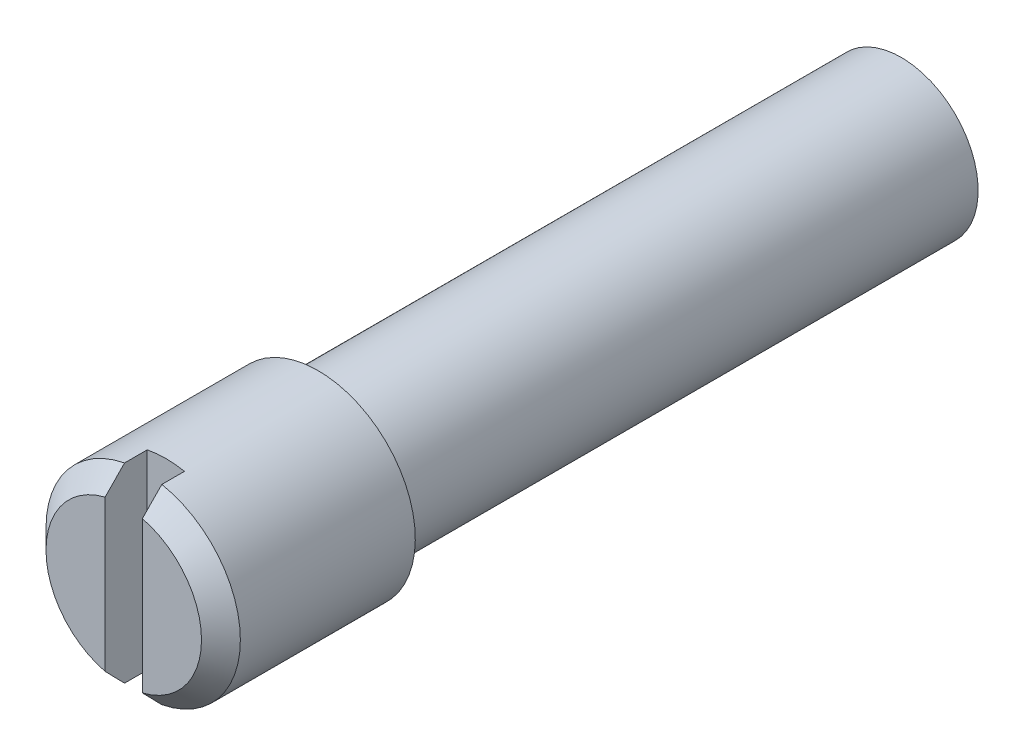
from build123d import *

# Parameters (mm, degrees)
ESQUISSE3_W             = 3
ESQUISSE3_H             = 24
CHANFREIN1_SIZE         = 0.6
ESQUISSE6_R             = 3.5
ENL_V_MAT_EXTRU_1_DEPTH = 25.505101524
ESQUISSE7_OUTSIDE_W     = 13.092
ESQUISSE7_OUTSIDE_H     = 13.092
ESQUISSE7_OUTSIDE_R     = 2.375
ENL_V_MAT_EXTRU_2_DEPTH = 18
ESQUISSE8_W             = 1.15
ESQUISSE8_H             = 7.450711795
ENL_V_MAT_EXTRU_3_DEPTH = 1.3


with BuildPart() as part:
    # Esquisse1 → Base-Révolution (revolve)
    with BuildSketch(Plane(origin=(0, 0, 0), x_dir=(1, 0, 0), z_dir=(0, 1, 0))):
        with BuildLine():
            Line((0, 0), (3.5, 0))
            Line((3.5, 0), (3.5, 3.6))
            ThreePointArc((3.5, 3.6), (3.382842712, 3.882842712), (3.1, 4))
            Line((3.1, 4), (0, 4))
            Line((0, 4), (0, 0))
        make_face()
    revolve(axis=Axis((0, 0, 0), (0, 0, -1)))

    # Esquisse3 → Boss.-Révol.1 (revolve)
    with BuildSketch(Plane(origin=(0, 0, 0), x_dir=(1, 0, 0), z_dir=(0, 1, 0))):
        with Locations((1.5, -12)):
            Rectangle(ESQUISSE3_W, ESQUISSE3_H)
    revolve(axis=Axis((0, 0, 0), (0, 0, 1)))

    # Chanfrein1
    chanfrein1_edges = [part.edges().sort_by_distance(p)[0] for p in [
        (-3, 0, 24),
    ]]
    chamfer(chanfrein1_edges, length=CHANFREIN1_SIZE)

    # Esquisse6 → Enlèv. mat.-Extru.1 (cut, through all)
    with BuildSketch(Plane.XY):
        Circle(ESQUISSE6_R)
    extrude(amount=-ENL_V_MAT_EXTRU_1_DEPTH, mode=Mode.SUBTRACT)

    # Esquisse7 outside → Enlèv. mat.-Extru.2 (cut)
    with BuildSketch(Plane(origin=(0, 0, 0), x_dir=(-1, 0, 0), z_dir=(0, 0, -1))):
        Rectangle(ESQUISSE7_OUTSIDE_W, ESQUISSE7_OUTSIDE_H)
        Circle(ESQUISSE7_OUTSIDE_R, mode=Mode.SUBTRACT)
    extrude(amount=-ENL_V_MAT_EXTRU_2_DEPTH, mode=Mode.SUBTRACT)

    # Esquisse8 → Enlèv. mat.-Extru.3 (cut)
    with BuildSketch(Plane.XY.offset(24)):
        with Locations((0, -0.141041798)):
            Rectangle(ESQUISSE8_W, ESQUISSE8_H)
    extrude(amount=-ENL_V_MAT_EXTRU_3_DEPTH, mode=Mode.SUBTRACT)


solid = part.part
